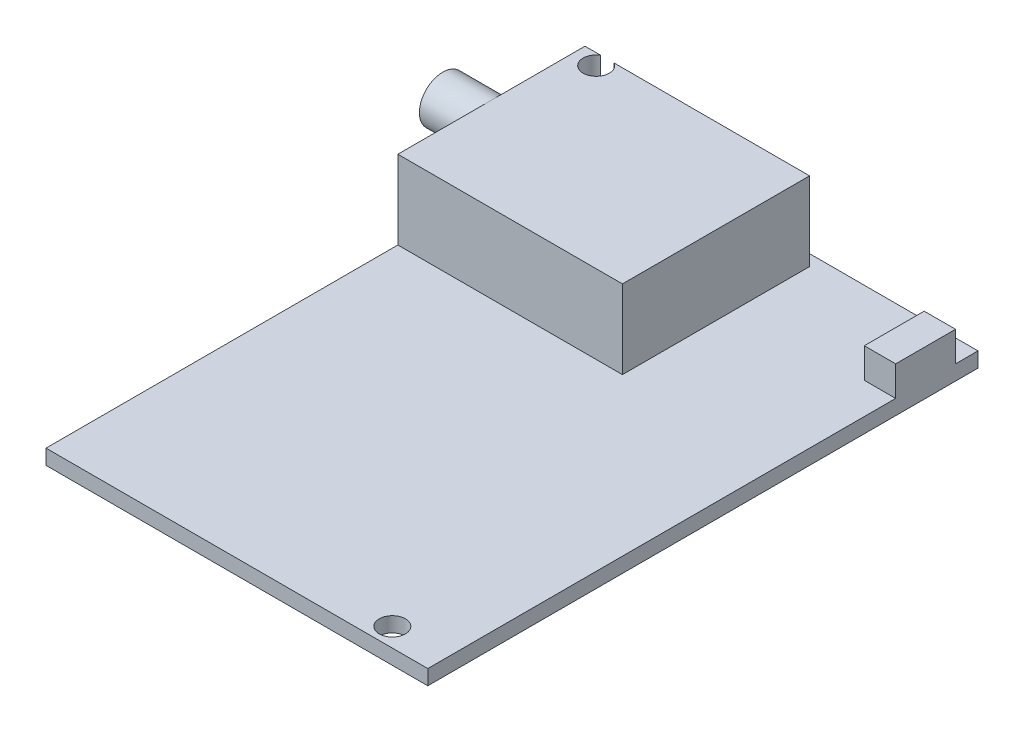
from build123d import *

# Parameters (mm, degrees)
SKETCH1_W               = 13.064472239
SKETCH1_H               = 20.176787348
BOSS_EXTRUDE1_DEPTH     = 5
SKETCH2_W               = 51
SKETCH2_H               = 73.5
BOSS_EXTRUDE2_DEPTH     = 2
SKETCH3_W               = 30
SKETCH3_H               = 25
BOSS_EXTRUDE3_DEPTH     = 10.5
SKETCH7_R               = 3.125
BOSS_EXTRUDE5_DEPTH     = 6.5
SKETCH8_W               = 4.189265903
SKETCH8_H               = 8
BOSS_EXTRUDE6_DEPTH     = 4
CUT_EXTRUDE1_DEPTH      = 70.538782979
CUT_EXTRUDE1_DEPTH_BACK = 70.538782979
SKETCH9_R               = 1.75


with BuildPart() as part:
    # Sketch1 → Boss-Extrude1 (new body)
    with BuildSketch(Plane(origin=(0, 0, 0), x_dir=(1, 0, 0), z_dir=(0, 1, 0))):
        with Locations((-6.53223612, 10.088393674)):
            Rectangle(SKETCH1_W, SKETCH1_H)
    extrude(amount=BOSS_EXTRUDE1_DEPTH)

    # Sketch2 → Boss-Extrude2 (add)
    with BuildSketch(Plane(origin=(0, 5, 0), x_dir=(1, 0, 0), z_dir=(0, 1, 0))):
        with Locations((-6.53223612, 20.176787348)):
            Rectangle(SKETCH2_W, SKETCH2_H)
    extrude(amount=BOSS_EXTRUDE2_DEPTH)

    # Sketch3 → Boss-Extrude3 (add)
    with BuildSketch(Plane(origin=(0, 7, 0), x_dir=(1, 0, 0), z_dir=(0, 1, 0))):
        with Locations((-17.03223612, 42.926787348)):
            Rectangle(SKETCH3_W, SKETCH3_H)
    extrude(amount=BOSS_EXTRUDE3_DEPTH)

    # Sketch7 → Boss-Extrude5 (add)
    with BuildSketch(Plane.ZY.offset(32.03223612)):
        with Locations(Location((-42.926787348, 14.375, 0), (0, 0, 90))):
            Circle(SKETCH7_R)
    extrude(amount=BOSS_EXTRUDE5_DEPTH)

    # Sketch8 → Boss-Extrude6 (add)
    with BuildSketch(Plane(origin=(0, 7, 0), x_dir=(1, 0, 0), z_dir=(0, 1, 0))):
        with Locations((16.873130929, 49.926787348)):
            Rectangle(SKETCH8_W, SKETCH8_H)
    extrude(amount=BOSS_EXTRUDE6_DEPTH)

    # Sketch9 → Cut-Extrude1 (cut, two sides: drawn at the far end of the back side and taken through both)
    with BuildSketch(Plane(origin=(0, 7, 0), x_dir=(1, 0, 0), z_dir=(0, 1, 0)).offset(-CUT_EXTRUDE1_DEPTH_BACK)):
        with Locations(Location((11.71776388, -14.063212652, 0), (0, 0, 270))):
            Circle(SKETCH9_R)
        with Locations(Location((-29.03223612, 53.926787348, 0), (0, 0, 270))):
            Circle(SKETCH9_R)
    extrude(amount=CUT_EXTRUDE1_DEPTH + CUT_EXTRUDE1_DEPTH_BACK, mode=Mode.SUBTRACT)


solid = part.part
